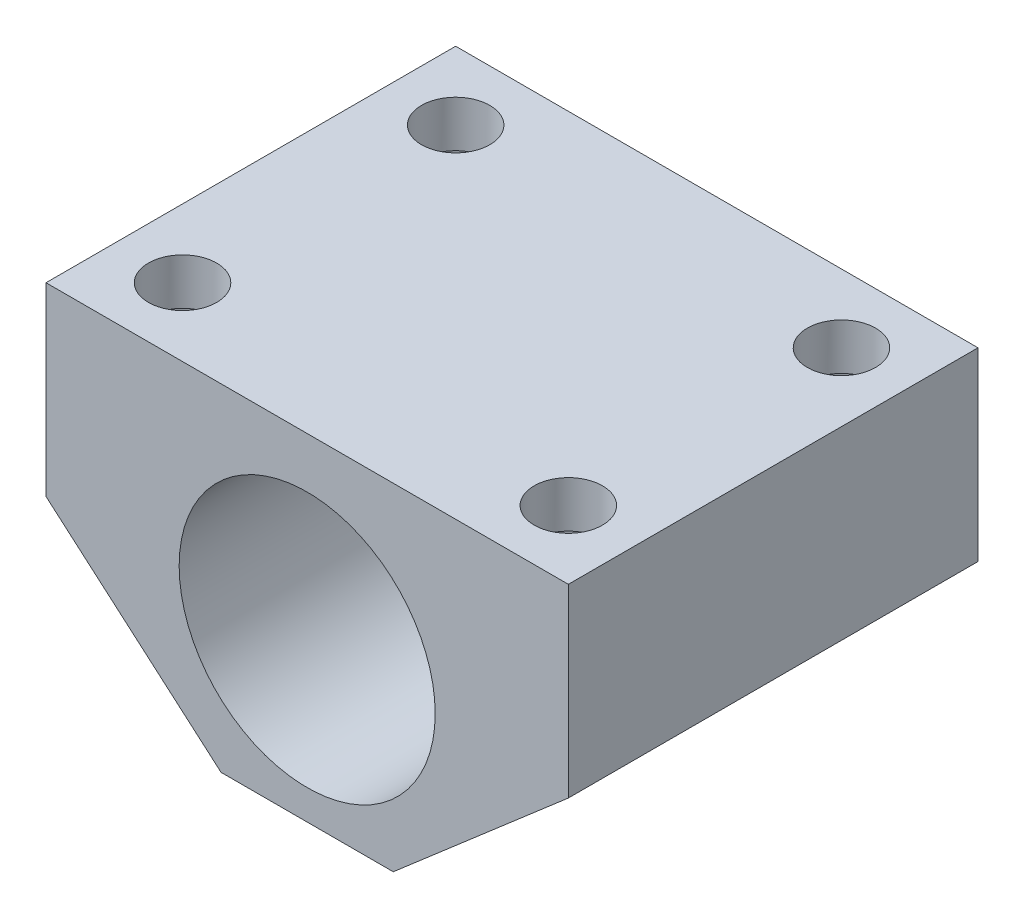
from build123d import *

# Parameters (mm, degrees)
BOSS_EXTRU_1_DEPTH      = 12
ESQUISSE2_R             = 2
ENL_V_MAT_EXTRU_1_DEPTH = 28.690963204
ESQUISSE4_R             = 3.7
ENL_V_MAT_EXTRU_2_DEPTH = 17


with BuildPart() as part:
    # Esquisse1 → Boss.-Extru.1 (new, symmetric)
    with BuildSketch(Plane.XY):
        with BuildLine():
            Line((15.300968977, -0.378320662), (15.300968977, 10.466871635))
            Line((15.300968977, 10.466871635), (0, 10.466871635))
            Line((0, 10.466871635), (0, 7.5))
            ThreePointArc((0, 7.5), (5.303300859, 5.303300859), (7.5, 0))
            ThreePointArc((7.5, 0), (5.303300859, -5.303300859), (0, -7.5))
            Line((0, -7.5), (0, -9.247838393))
            Line((0, -9.247838393), (5.044275487, -9.247838393))
            Line((5.044275487, -9.247838393), (15.300968977, -0.378320662))
        make_face()
        with BuildLine():
            Line((0, 7.5), (0, 10.466871635))
            Line((0, 10.466871635), (-15.300968977, 10.466871635))
            Line((-15.300968977, 10.466871635), (-15.300968977, -0.378320662))
            Line((-15.300968977, -0.378320662), (-5.044275487, -9.247838393))
            Line((-5.044275487, -9.247838393), (0, -9.247838393))
            Line((0, -9.247838393), (0, -7.5))
            ThreePointArc((0, -7.5), (-7.5, 0), (0, 7.5))
        make_face()
    extrude(amount=BOSS_EXTRU_1_DEPTH, both=True)

    # Esquisse2 → Enlèv. mat.-Extru.1 (cut, through all)
    with BuildSketch(Plane(origin=(0, 10.466871635, 0), x_dir=(1, 0, 0), z_dir=(0, 1, 0))):
        with Locations(Location((-11.300968977, 8, 0), (0, 0, 270))):
            Circle(ESQUISSE2_R)
        with Locations(Location((-11.300968977, -8, 0), (0, 0, 270))):
            Circle(ESQUISSE2_R)
        with Locations(Location((11.300968977, -8, 0), (0, 0, 270))):
            Circle(ESQUISSE2_R)
        with Locations(Location((11.300968977, 8, 0), (0, 0, 270))):
            Circle(ESQUISSE2_R)
    extrude(amount=-ENL_V_MAT_EXTRU_1_DEPTH, mode=Mode.SUBTRACT)

    # Esquisse4 → Enlèv. mat.-Extru.2 (cut)
    with BuildSketch(Plane.XZ.offset(9.247838393)):
        with Locations(Location((-11.300968977, 8, 0), (0, 0, 270))):
            Circle(ESQUISSE4_R)
        with Locations(Location((-11.300968977, -8, 0), (0, 0, 270))):
            Circle(ESQUISSE4_R)
        with Locations(Location((11.300968977, 8, 0), (0, 0, 270))):
            Circle(ESQUISSE4_R)
        with Locations(Location((11.300968977, -8, 0), (0, 0, 270))):
            Circle(ESQUISSE4_R)
    extrude(amount=-ENL_V_MAT_EXTRU_2_DEPTH, mode=Mode.SUBTRACT)


solid = part.part
